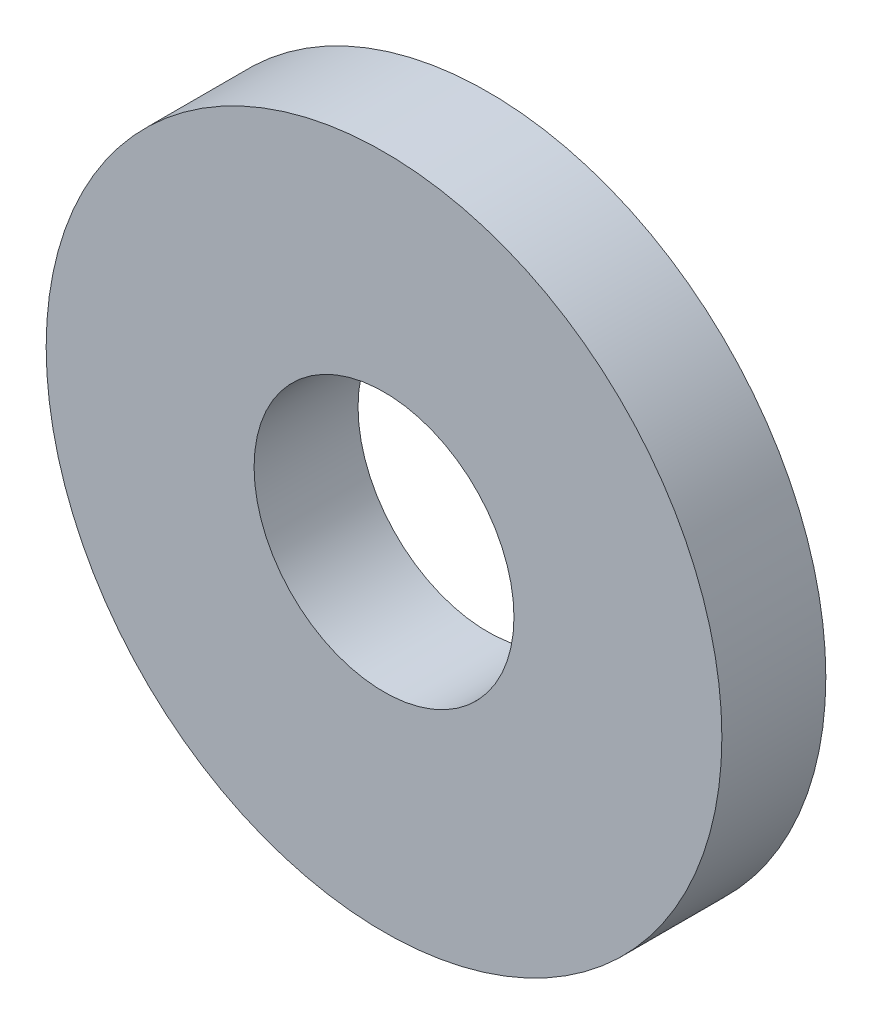
from build123d import *

# Parameters (mm, degrees)
SKETCH1_R           = 6.5
SKETCH1_R_2         = 2.5
BOSS_EXTRUDE1_DEPTH = 2


with BuildPart() as part:
    # Sketch1 → Boss-Extrude1 (new body)
    with BuildSketch(Plane.XY):
        Circle(SKETCH1_R)
        Circle(SKETCH1_R_2, mode=Mode.SUBTRACT)
    extrude(amount=BOSS_EXTRUDE1_DEPTH)


solid = part.part
